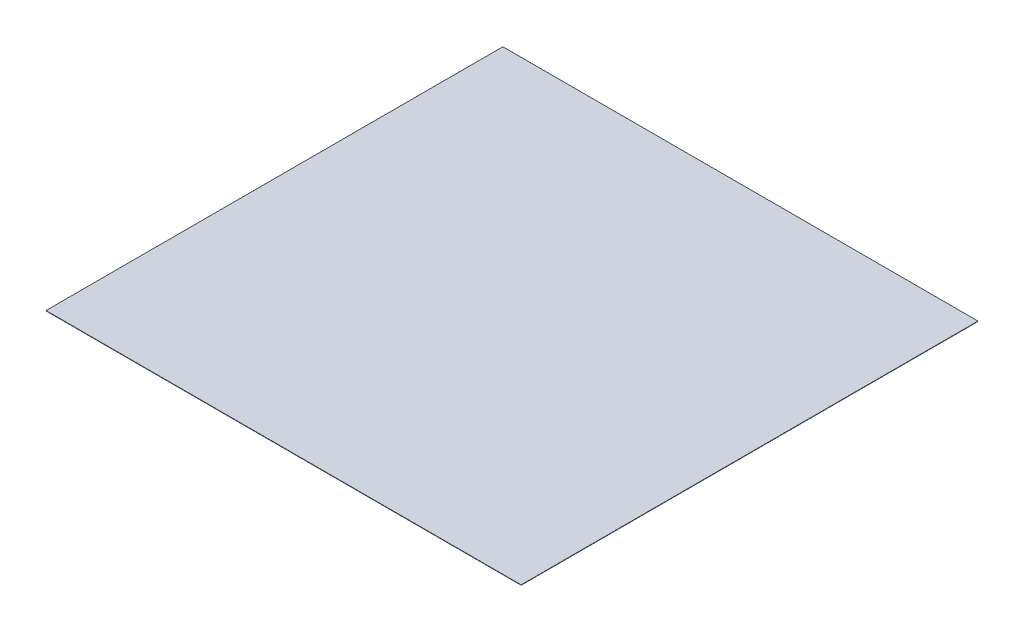
from build123d import *

# Parameters (mm, degrees)
SKETCH_1_W      = 260
SKETCH_1_H      = 250
EXTRUDE_1_DEPTH = 0.2


with BuildPart() as part:
    # 草图1 → 凸台-拉伸1 (new body)
    with BuildSketch(Plane(origin=(0, 0, 0), x_dir=(1, 0, 0), z_dir=(0, 1, 0))):
        with Locations((130, 125)):
            Rectangle(SKETCH_1_W, SKETCH_1_H)
    extrude(amount=EXTRUDE_1_DEPTH)


solid = part.part
